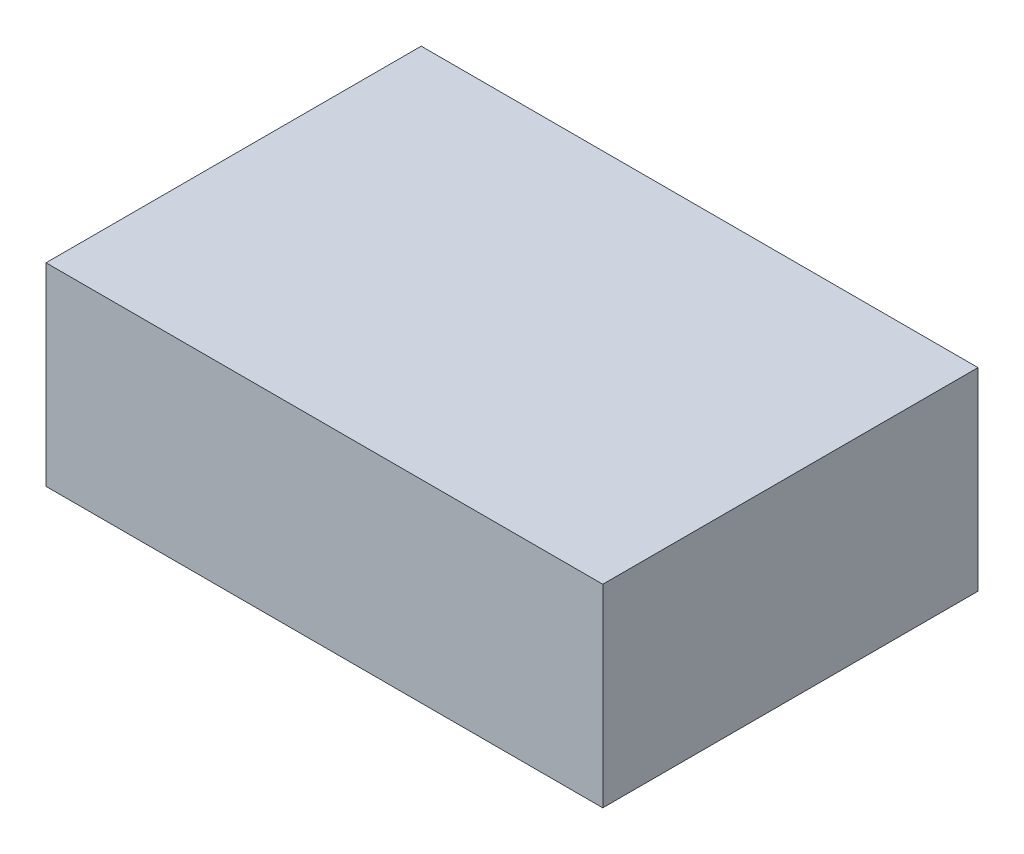
from build123d import *

# Parameters (mm, degrees)
SKETCH1_W           = 46
SKETCH1_H           = 31
BOSS_EXTRUDE1_DEPTH = 16


with BuildPart() as part:
    # Sketch1 → Boss-Extrude1 (new body)
    with BuildSketch(Plane(origin=(0, 0, 0), x_dir=(1, 0, 0), z_dir=(0, 1, 0))):
        Rectangle(SKETCH1_W, SKETCH1_H)
    extrude(amount=BOSS_EXTRUDE1_DEPTH)


solid = part.part
